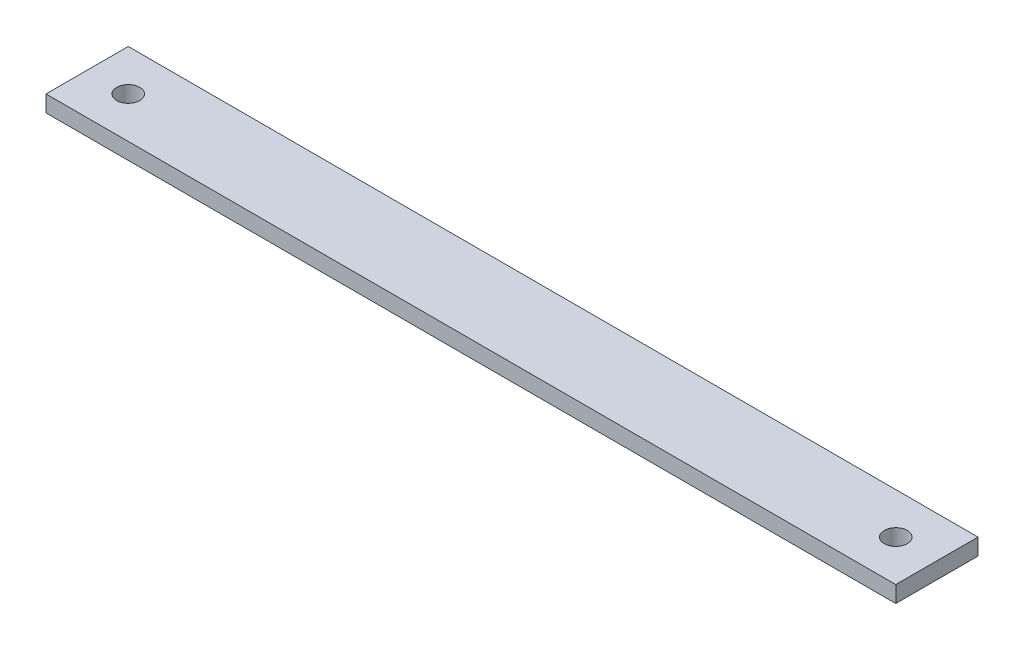
from build123d import *

# Parameters (mm, degrees)
SKETCH1_W           = 155
SKETCH1_H           = 15
BOSS_EXTRUDE1_DEPTH = 3
SKETCH2_R           = 2.1
CUT_EXTRUDE1_DEPTH  = 3


with BuildPart() as part:
    # Sketch1 → Boss-Extrude1 (new body)
    with BuildSketch(Plane(origin=(0, 0, 0), x_dir=(1, 0, 0), z_dir=(0, 1, 0))):
        with Locations((18.088235294, 5.882352941)):
            Rectangle(SKETCH1_W, SKETCH1_H)
    extrude(amount=BOSS_EXTRUDE1_DEPTH)

    # Sketch2 → Cut-Extrude1 (cut)
    with BuildSketch(Plane(origin=(0, 3, 0), x_dir=(1, 0, 0), z_dir=(0, 1, 0))):
        with Locations(Location((-51.911764706, 5.882352941, 0), (0, 0, 270))):
            Circle(SKETCH2_R)
        with Locations(Location((88.088235294, 5.882352941, 0), (0, 0, 270))):
            Circle(SKETCH2_R)
    extrude(amount=-CUT_EXTRUDE1_DEPTH, mode=Mode.SUBTRACT)


solid = part.part
